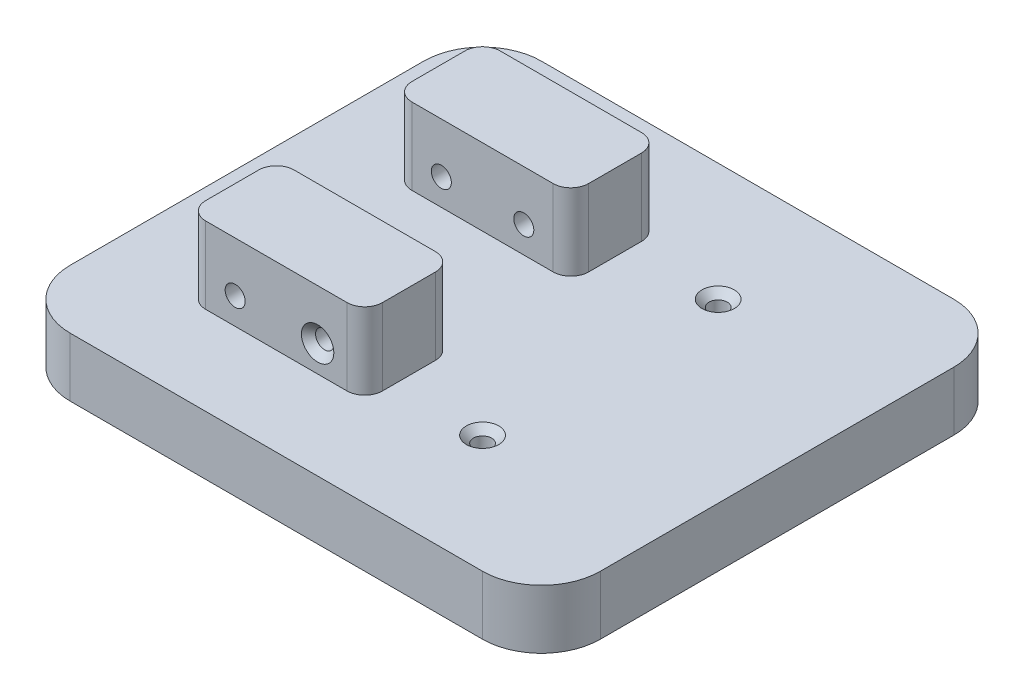
from build123d import *

# Parameters (mm, degrees)
SCHIZZO1_W                               = 90
SCHIZZO1_H                               = 80
ESTRUSIONE_ESTRUSIONE1_DEPTH             = 10
RACCORDO1_R                              = 10
FORO_SVASATO_PER_VITE_M2_5_1_D           = 3.1
FORO_SVASATO_PER_VITE_M2_5_1_CSINK_D     = 5.5
FORO_SVASATO_PER_VITE_M2_5_1_CSINK_ANGLE = 90
SCHIZZO4_W                               = 30
SCHIZZO4_H                               = 15
ESTRUSIONE_ESTRUSIONE2_DEPTH             = 13
FORO_SVASATO_PER_VITE_M2_5_2_D           = 3.1
FORO_SVASATO_PER_VITE_M2_5_2_DEPTH       = 15
FORO_SVASATO_PER_VITE_M2_5_2_CSINK_D     = 5.5
FORO_SVASATO_PER_VITE_M2_5_2_CSINK_ANGLE = 90
FORO_SVASATO_PER_VITE_M2_5_2_TIP         = 0.931333959
RACCORDO2_R                              = 3
SCHIZZO5_R                               = 1.7
TAGLIO_ESTRUSIONE4_DEPTH                 = 15
TAGLIO_ESTRUSIONE5_START                 = -15
SCHIZZO6_R                               = 1.7
TAGLIO_ESTRUSIONE5_DEPTH                 = 15


with BuildPart() as part:
    # Schizzo1 → Estrusione-Estrusione1 (new body)
    with BuildSketch(Plane(origin=(0, 0, 0), x_dir=(1, 0, 0), z_dir=(0, 1, 0))):
        with Locations((-2.6, -4.4)):
            Rectangle(SCHIZZO1_W, SCHIZZO1_H)
    extrude(amount=ESTRUSIONE_ESTRUSIONE1_DEPTH)

    # Raccordo1
    raccordo1_edges = [part.edges().sort_by_distance(p)[0] for p in [
        (42.4, 5, -35.6),
        (42.4, 5, 44.4),
        (-47.6, 5, 44.4),
        (-47.6, 5, -35.6),
    ]]
    fillet(raccordo1_edges, radius=RACCORDO1_R)

    # Foro svasato per Vite M2.5-1 (through all)
    with Locations(Plane(origin=(12.4, 10, -15.6), x_dir=(0, 0, 1), z_dir=(0, 1, 0))):
        with Locations((0, 0), (40, 0)):
            CounterSinkHole(FORO_SVASATO_PER_VITE_M2_5_1_D / 2, FORO_SVASATO_PER_VITE_M2_5_1_CSINK_D / 2, counter_sink_angle=FORO_SVASATO_PER_VITE_M2_5_1_CSINK_ANGLE)

    # Schizzo4 → Estrusione-Estrusione2 (add)
    with BuildSketch(Plane(origin=(0, 10, 0), x_dir=(1, 0, 0), z_dir=(0, 1, 0))):
        with Locations((-17.6, 13.1)):
            Rectangle(SCHIZZO4_W, SCHIZZO4_H)
        with Locations((-17.6, -21.9)):
            Rectangle(SCHIZZO4_W, SCHIZZO4_H)
    extrude(amount=ESTRUSIONE_ESTRUSIONE2_DEPTH)

    # Foro svasato per Vite M2.5-2
    with Locations(Plane(origin=(-10.6, 14.5, 29.4), x_dir=(1, 0, 0), z_dir=(0, 0, 1))):
        with Locations((0, 0)):
            CounterSinkHole(FORO_SVASATO_PER_VITE_M2_5_2_D / 2, FORO_SVASATO_PER_VITE_M2_5_2_CSINK_D / 2, depth=FORO_SVASATO_PER_VITE_M2_5_2_DEPTH, counter_sink_angle=FORO_SVASATO_PER_VITE_M2_5_2_CSINK_ANGLE)
            with Locations((0, 0, -(FORO_SVASATO_PER_VITE_M2_5_2_DEPTH + FORO_SVASATO_PER_VITE_M2_5_2_TIP / 2))):  # 118° drill point
                Cone(0, FORO_SVASATO_PER_VITE_M2_5_2_D / 2, FORO_SVASATO_PER_VITE_M2_5_2_TIP, mode=Mode.SUBTRACT)

    # Raccordo2
    raccordo2_edges = [part.edges().sort_by_distance(p)[0] for p in [
        (-2.6, 16.5, -20.6),
        (-32.6, 16.5, -20.6),
        (-32.6, 16.5, -5.6),
        (-2.6, 16.5, -5.6),
        (-2.6, 16.5, 14.4),
        (-32.6, 16.5, 14.4),
        (-32.6, 16.5, 29.4),
        (-2.6, 16.5, 29.4),
    ]]
    fillet(raccordo2_edges, radius=RACCORDO2_R)

    # Schizzo5 → Taglio-Estrusione4 (cut)
    with BuildSketch(Plane(origin=(0, 0, -20.6), x_dir=(-1, 0, 0), z_dir=(0, 0, -1))):
        with Locations((10.6, 14.5)):
            Circle(SCHIZZO5_R)
        with Locations((24.6, 14.5)):
            Circle(SCHIZZO5_R)
    extrude(amount=-TAGLIO_ESTRUSIONE4_DEPTH, mode=Mode.SUBTRACT)

    # Schizzo6 → Taglio-Estrusione5 (cut)
    with BuildSketch(Plane.XY.offset(29.4).offset(TAGLIO_ESTRUSIONE5_START)):
        with Locations(Location((-24.6, 14.5, 0), (0, 0, 180))):
            Circle(SCHIZZO6_R)
    extrude(amount=TAGLIO_ESTRUSIONE5_DEPTH, mode=Mode.SUBTRACT)


solid = part.part
